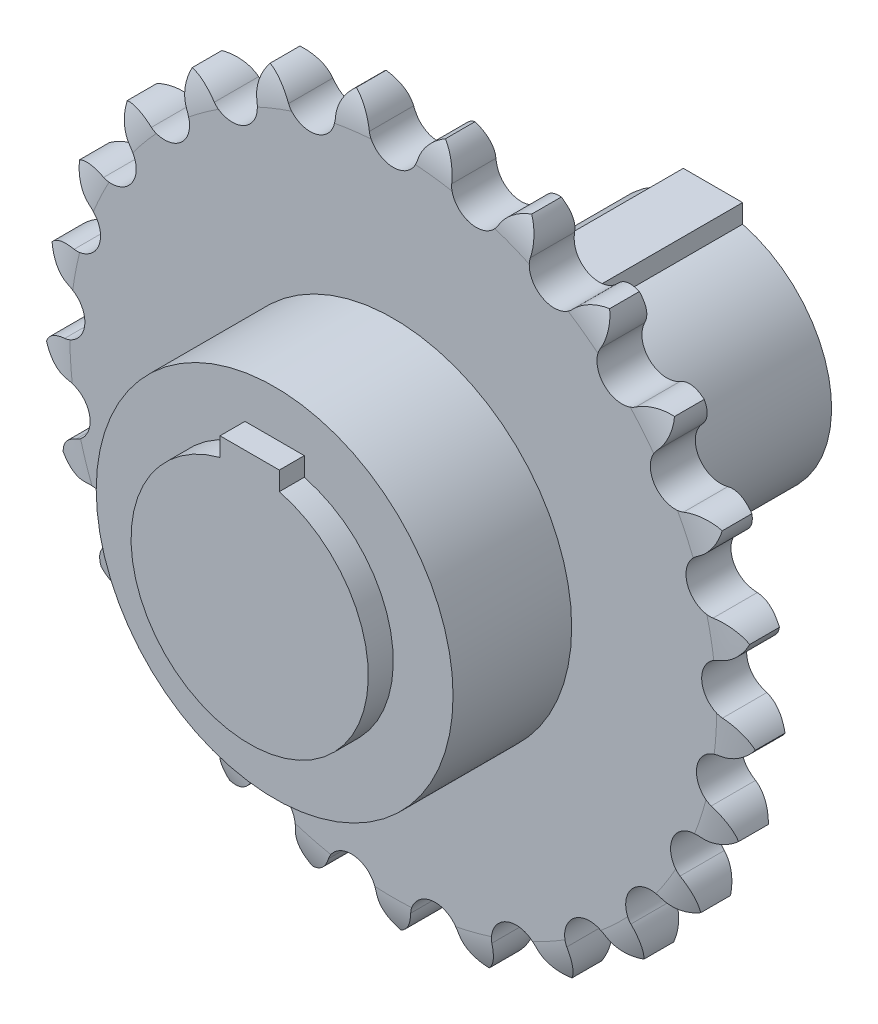
from build123d import *

# Parameters (mm, degrees)
CROQUIS1_R                   = 19
SALIENTE_EXTRUIR1_DEPTH      = 3.6
CROQUIS2_R                   = 28.575
CROQUIS2_R_2                 = 19
SALIENTE_EXTRUIR2_DEPTH      = 19
CROQUIS3_W                   = 9.5
CROQUIS3_H                   = 4.8
CORTAR_EXTRUIR1_DEPTH        = 85.518395836
SALIENTE_EXTRUIR4_DEPTH      = 4
SALIENTE_EXTRUIR4_DEPTH_BACK = 70.2
CORTAR_EXTRUIR2_DEPTH        = 52


with BuildPart() as part:
    # Croquis1 → Saliente-Extruir1 (new, symmetric)
    with BuildSketch(Plane.XY):
        with BuildLine():
            ThreePointArc((3.880781439, 52.530703644), (0, 49.5), (-3.880781439, 52.530703644))
            ThreePointArc((-3.880781439, 52.530703644), (-5.058625162, 54.850631023), (-7.128405784, 56.427142063))
            ThreePointArc((-7.128405784, 56.427142063), (-8.741098089, 54.385426507), (-9.304995208, 51.84546609))
            ThreePointArc((-9.304995208, 51.84546609), (-12.310149415, 47.944866476), (-16.822714315, 49.915243894))
            ThreePointArc((-16.822714315, 49.915243894), (-18.540496391, 51.869368666), (-20.937313401, 52.881617202))
            ThreePointArc((-20.937313401, 52.881617202), (-21.991586001, 50.502985628), (-21.906104785, 47.902587227))
            ThreePointArc((-21.906104785, 47.902587227), (-23.846806868, 43.377180662), (-28.707614182, 44.163425794))
            ThreePointArc((-28.707614182, 44.163425794), (-30.857400044, 45.628963112), (-33.430652615, 46.013345848))
            ThreePointArc((-33.430652615, 46.013345848), (-33.860261684, 43.447256425), (-33.130773233, 40.949812636))
            ThreePointArc((-33.130773233, 40.949812636), (-33.885081743, 36.083947057), (-38.788709071, 35.63665723))
            ThreePointArc((-38.788709071, 35.63665723), (-41.235419766, 36.521521995), (-43.823420975, 36.253886749))
            ThreePointArc((-43.823420975, 36.253886749), (-43.601372597, 33.661576313), (-42.273713353, 31.424010713))
            ThreePointArc((-42.273713353, 31.424010713), (-41.794232312, 26.523426351), (-46.432566713, 24.87070643))
            ThreePointArc((-46.432566713, 24.87070643), (-49.022466412, 25.119299335), (-51.462602625, 24.216462613))
            ThreePointArc((-51.462602625, 24.216462613), (-50.602848914, 21.760815562), (-48.76044059, 19.923722628))
            ThreePointArc((-48.76044059, 19.923722628), (-47.077297557, 15.296341222), (-51.158895422, 12.542037677))
            ThreePointArc((-51.158895422, 12.542037677), (-53.729251201, 12.138738714), (-55.868199685, 10.657429069))
            ThreePointArc((-55.868199685, 10.657429069), (-54.42476213, 8.49274274), (-52.183370017, 7.171553776))
            ThreePointArc((-52.183370017, 7.171553776), (-49.402323057, 3.108130717), (-52.670722583, -0.57469343))
            ThreePointArc((-52.670722583, -0.57469343), (-55.060029534, -1.604543503), (-56.76339229, -3.571249938))
            ThreePointArc((-56.76339229, -3.571249938), (-54.826967381, -5.308960344), (-52.327426389, -6.031230175))
            ThreePointArc((-52.327426389, -6.031230175), (-48.623218911, -9.275375072), (-50.873054534, -13.655314435))
            ThreePointArc((-50.873054534, -13.655314435), (-52.931183716, -15.24700635), (-54.091932197, -17.575534178))
            ThreePointArc((-54.091932197, -17.575534178), (-51.784192633, -18.777081924), (-49.183558114, -18.855049753))
            ThreePointArc((-49.183558114, -18.855049753), (-44.788939097, -21.076074932), (-45.878845371, -25.877921813))
            ThreePointArc((-45.878845371, -25.877921813), (-47.476476957, -27.931443714), (-48.021677067, -30.475482967))
            ThreePointArc((-48.021677067, -30.475482967), (-45.487626612, -31.065370389), (-42.949305998, -30.49413721))
            ThreePointArc((-42.949305998, -30.49413721), (-38.140405517, -31.552487493), (-38.001899622, -36.474524192))
            ThreePointArc((-38.001899622, -36.474524192), (-39.038648544, -38.860845745), (-38.934043356, -41.46054508))
            ThreePointArc((-38.934043356, -41.46054508), (-36.332905719, -41.401707383), (-34.01639103, -40.217165878))
            ThreePointArc((-34.01639103, -40.217165878), (-29.095369988, -40.046341222), (-27.737154759, -44.779298072))
            ThreePointArc((-27.737154759, -44.779298072), (-28.14787827, -47.348477917), (-27.400040511, -49.840488665))
            ThreePointArc((-27.400040511, -49.840488665), (-24.895254737, -49.136622836), (-22.94610111, -47.413202104))
            ThreePointArc((-22.94610111, -47.413202104), (-18.222165358, -46.023936051), (-15.729582453, -50.270423967))
            ThreePointArc((-15.729582453, -50.270423967), (-15.488473283, -52.861031087), (-14.144392351, -55.088771047))
            ThreePointArc((-14.144392351, -55.088771047), (-11.893343341, -53.784103566), (-10.434023267, -51.630092469))
            ThreePointArc((-10.434023267, -51.630092469), (-6.203995061, -49.109677715), (-2.733662631, -52.602874242))
            ThreePointArc((-2.733662631, -52.602874242), (-1.855870557, -55.052131263), (0, -56.875623341))
            ThreePointArc((0, -56.875623341), (1.855870557, -55.052131263), (2.733662631, -52.602874242))
            ThreePointArc((2.733662631, -52.602874242), (6.203995061, -49.109677715), (10.434023267, -51.630092469))
            ThreePointArc((10.434023267, -51.630092469), (11.893343341, -53.784103566), (14.144392351, -55.088771047))
            ThreePointArc((14.144392351, -55.088771047), (15.488473283, -52.861031087), (15.729582453, -50.270423967))
            ThreePointArc((15.729582453, -50.270423967), (18.222165358, -46.023936051), (22.94610111, -47.413202104))
            ThreePointArc((22.94610111, -47.413202104), (24.895254737, -49.136622836), (27.400040511, -49.840488665))
            ThreePointArc((27.400040511, -49.840488665), (28.14787827, -47.348477917), (27.737154759, -44.779298072))
            ThreePointArc((27.737154759, -44.779298072), (29.095369988, -40.046341222), (34.01639103, -40.217165878))
            ThreePointArc((34.01639103, -40.217165878), (36.332905719, -41.401707383), (38.934043356, -41.46054508))
            ThreePointArc((38.934043356, -41.46054508), (39.038648544, -38.860845745), (38.001899622, -36.474524192))
            ThreePointArc((38.001899622, -36.474524192), (38.140405517, -31.552487493), (42.949305998, -30.49413721))
            ThreePointArc((42.949305998, -30.49413721), (45.487626612, -31.065370389), (48.021677067, -30.475482967))
            ThreePointArc((48.021677067, -30.475482967), (47.476476957, -27.931443714), (45.878845371, -25.877921813))
            ThreePointArc((45.878845371, -25.877921813), (44.788939097, -21.076074932), (49.183558114, -18.855049753))
            ThreePointArc((49.183558114, -18.855049753), (51.784192633, -18.777081924), (54.091932197, -17.575534178))
            ThreePointArc((54.091932197, -17.575534178), (52.931183716, -15.24700635), (50.873054534, -13.655314435))
            ThreePointArc((50.873054534, -13.655314435), (48.623218911, -9.275375072), (52.327426389, -6.031230175))
            ThreePointArc((52.327426389, -6.031230175), (54.826967381, -5.308960344), (56.76339229, -3.571249938))
            ThreePointArc((56.76339229, -3.571249938), (55.060029534, -1.604543503), (52.670722583, -0.57469343))
            ThreePointArc((52.670722583, -0.57469343), (49.402323057, 3.108130717), (52.183370017, 7.171553776))
            ThreePointArc((52.183370017, 7.171553776), (54.42476213, 8.49274274), (55.868199685, 10.657429069))
            ThreePointArc((55.868199685, 10.657429069), (53.729251201, 12.138738714), (51.158895422, 12.542037677))
            ThreePointArc((51.158895422, 12.542037677), (47.077297557, 15.296341222), (48.76044059, 19.923722628))
            ThreePointArc((48.76044059, 19.923722628), (50.602848914, 21.760815562), (51.462602625, 24.216462613))
            ThreePointArc((51.462602625, 24.216462613), (49.022466412, 25.119299335), (46.432566713, 24.87070643))
            ThreePointArc((46.432566713, 24.87070643), (41.794232312, 26.523426351), (42.273713353, 31.424010713))
            ThreePointArc((42.273713353, 31.424010713), (43.601372597, 33.661576313), (43.823420975, 36.253886749))
            ThreePointArc((43.823420975, 36.253886749), (41.235419766, 36.521521995), (38.788709071, 35.63665723))
            ThreePointArc((38.788709071, 35.63665723), (33.885081743, 36.083947057), (33.130773233, 40.949812636))
            ThreePointArc((33.130773233, 40.949812636), (33.860261684, 43.447256425), (33.430652615, 46.013345848))
            ThreePointArc((33.430652615, 46.013345848), (30.857400044, 45.628963112), (28.707614182, 44.163425794))
            ThreePointArc((28.707614182, 44.163425794), (23.846806868, 43.377180662), (21.906104785, 47.902587227))
            ThreePointArc((21.906104785, 47.902587227), (21.991586001, 50.502985628), (20.937313401, 52.881617202))
            ThreePointArc((20.937313401, 52.881617202), (18.540496391, 51.869368666), (16.822714315, 49.915243894))
            ThreePointArc((16.822714315, 49.915243894), (12.310149415, 47.944866476), (9.304995208, 51.84546609))
            ThreePointArc((9.304995208, 51.84546609), (8.741098089, 54.385426507), (7.128405784, 56.427142063))
            ThreePointArc((7.128405784, 56.427142063), (5.058625162, 54.850631023), (3.880781439, 52.530703644))
        make_face()
        Circle(CROQUIS1_R, mode=Mode.SUBTRACT)
    extrude(amount=SALIENTE_EXTRUIR1_DEPTH, both=True)

    # Croquis2 → Saliente-Extruir2 (add)
    with BuildSketch(Plane.XY.offset(3.6)):
        Circle(CROQUIS2_R)
        Circle(CROQUIS2_R_2, mode=Mode.SUBTRACT)
    extrude(amount=SALIENTE_EXTRUIR2_DEPTH)

    # Croquis3 → Cortar-Extruir1 (cut, through all)
    with BuildSketch(Plane.XY.offset(22.6)):
        with Locations((0, 19)):
            Rectangle(CROQUIS3_W, CROQUIS3_H)
    extrude(amount=-CORTAR_EXTRUIR1_DEPTH, mode=Mode.SUBTRACT)

    # Croquis4 → Cortar-Revolución1 (revolve, cut)
    with BuildSketch(Plane(origin=(0, 0, 0), x_dir=(0, 0, -1), z_dir=(1, 0, 0))):
        with BuildLine():
            Line((-2.1, 57.427142063), (-9.350199674, 57.427142063))
            Line((-9.350199674, 57.427142063), (-9.350199674, 51.077142063))
            Line((-9.350199674, 51.077142063), (-3.6, 51.077142063))
            ThreePointArc((-3.6, 51.077142063), (-3.26475648, 54.350116034), (-2.1, 57.427142063))
        make_face()
        with BuildLine():
            Line((9.350199674, 51.077142063), (3.6, 51.077142063))
            ThreePointArc((3.6, 51.077142063), (3.26475648, 54.350116034), (2.1, 57.427142063))
            Line((2.1, 57.427142063), (9.350199674, 57.427142063))
            Line((9.350199674, 57.427142063), (9.350199674, 51.077142063))
        make_face()
    revolve(axis=Axis((0, 0, 22.6), (0, 0, -1)), mode=Mode.SUBTRACT)

    # Croquis5 → Saliente-Extruir4 (add, two sides: drawn at the far end of the back side and taken through both)
    with BuildSketch(Plane.XY.offset(22.6).offset(-SALIENTE_EXTRUIR4_DEPTH_BACK)):
        with BuildLine():
            Line((-4.75, 18.396670894), (-4.75, 21.4))
            Line((-4.75, 21.4), (4.75, 21.4))
            Line((4.75, 21.4), (4.75, 18.396670894))
            ThreePointArc((4.75, 18.396670894), (0, -19), (-4.75, 18.396670894))
        make_face()
    extrude(amount=SALIENTE_EXTRUIR4_DEPTH + SALIENTE_EXTRUIR4_DEPTH_BACK)

    # Croquis6 → Cortar-Extruir2 (cut)
    with BuildSketch(Plane(origin=(0, 0, -47.6), x_dir=(-1, 0, 0), z_dir=(0, 0, -1))):
        with BuildLine():
            Line((-3, 5.00298686), (-3, 7.95298686))
            ThreePointArc((-3, 7.95298686), (0, -8.5), (3, 7.95298686))
            Line((3, 7.95298686), (3, 5.00298686))
            Line((3, 5.00298686), (-3, 5.00298686))
        make_face()
    extrude(amount=-CORTAR_EXTRUIR2_DEPTH, mode=Mode.SUBTRACT)


solid = part.part
